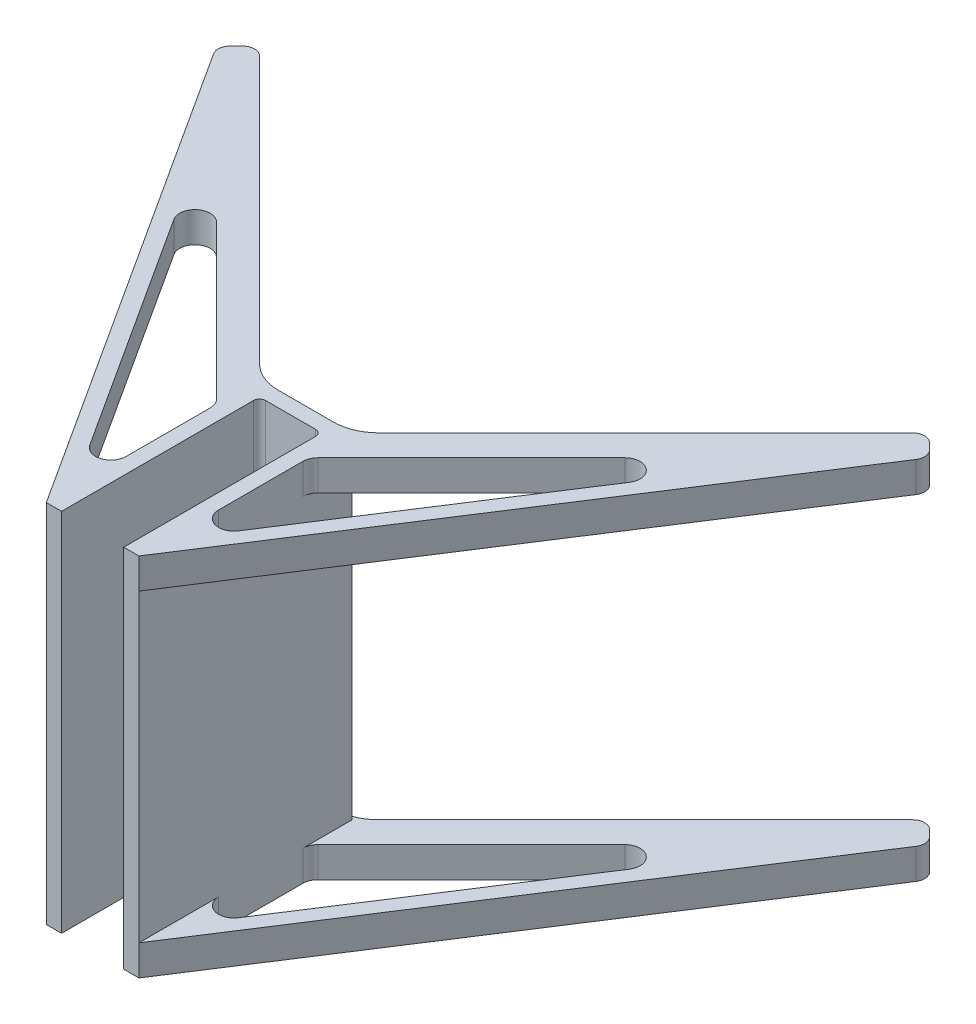
from build123d import *

# Parameters (mm, degrees)
BOSS_EXTRUDE1_DEPTH = 120
BOSS_EXTRUDE2_DEPTH = 10
BOSS_EXTRUDE3_START = 120
BOSS_EXTRUDE3_DEPTH = 10
FILLET1_R           = 5
FILLET2_R           = 15
FILLET3_R           = 2
FILLET4_R           = 4


with BuildPart() as part:
    # Sketch1 → Boss-Extrude1 (new body)
    with BuildSketch(Plane(origin=(0, 0, 0), x_dir=(1, 0, 0), z_dir=(0, 1, 0))):
        Polygon((-15.2, -55.784127273), (-15.2, -65), (-10.2, -65), (-10.2, -20.4), (-10.2, 0), (10.2, 0), (10.2, -20.4), (10.2, -65), (15.2, -65), (15.2, -55.784127273), (15.2, -9.142135624), (15.2, 5), (-15.2, 5), (-15.2, -9.142135624), align=None)
    extrude(amount=BOSS_EXTRUDE1_DEPTH)

    # Sketch1<3> → Boss-Extrude2 (add)
    with BuildSketch(Plane(origin=(0, 0, 0), x_dir=(1, 0, 0), z_dir=(0, 1, 0))):
        Polygon((-110, 99.8), (-117.071067812, 92.728932188), (-100.263572466, 75.921436842), (-15.2, -9.142135624), (-15.2, 5), align=None)
        Polygon((110, 99.8), (15.2, 5), (15.2, -9.142135624), (100.263572466, 75.921436842), (117.071067812, 92.728932188), align=None)
        Polygon((100.263572466, 75.921436842), (15.2, -55.784127273), (15.2, -65), (117.071067812, 92.728932188), align=None)
        Polygon((-100.263572466, 75.921436842), (-117.071067812, 92.728932188), (-15.2, -65), (-15.2, -55.784127273), align=None)
    extrude(amount=BOSS_EXTRUDE2_DEPTH)

    # Sketch1<4> → Boss-Extrude3 (add)
    with BuildSketch(Plane(origin=(0, 0, 0), x_dir=(1, 0, 0), z_dir=(0, 1, 0)).offset(BOSS_EXTRUDE3_START)):
        Polygon((-110, 99.8), (-117.071067812, 92.728932188), (-100.263572466, 75.921436842), (-15.2, -9.142135624), (-15.2, 5), align=None)
        Polygon((-100.263572466, 75.921436842), (-117.071067812, 92.728932188), (-15.2, -65), (-15.2, -55.784127273), align=None)
        Polygon((110, 99.8), (15.2, 5), (15.2, -9.142135624), (100.263572466, 75.921436842), (117.071067812, 92.728932188), align=None)
        Polygon((100.263572466, 75.921436842), (15.2, -55.784127273), (15.2, -65), (117.071067812, 92.728932188), align=None)
    extrude(amount=-BOSS_EXTRUDE3_DEPTH)

    # Fillet1
    fillet1_edges = [part.edges().sort_by_distance(p)[0] for p in [
        (15.2, 5, 9.142135624),
        (100.263572466, 5, -75.921436842),
        (15.2, 5, 55.784127273),
        (-15.2, 5, 55.784127273),
        (-100.263572466, 5, -75.921436842),
        (-15.2, 5, 9.142135624),
        (-100.263572466, 115, -75.921436842),
        (-15.2, 115, 55.784127273),
        (-15.2, 115, 9.142135624),
        (15.2, 115, 55.784127273),
        (100.263572466, 115, -75.921436842),
        (15.2, 115, 9.142135624),
    ]]
    fillet(fillet1_edges, radius=FILLET1_R)

    # Fillet2
    fillet2_edges = [part.edges().sort_by_distance(p)[0] for p in [
        (-15.2, 115, -5),
        (15.2, 115, -5),
        (15.2, 5, -5),
        (-15.2, 5, -5),
    ]]
    fillet(fillet2_edges, radius=FILLET2_R)

    # Fillet3
    fillet3_edges = [part.edges().sort_by_distance(p)[0] for p in [
        (10.2, 60, 0),
        (-10.2, 60, 0),
    ]]
    fillet(fillet3_edges, radius=FILLET3_R)

    # Fillet4
    fillet4_edges = [part.edges().sort_by_distance(p)[0] for p in [
        (117.071067812, 5, -92.728932188),
        (110, 5, -99.8),
        (-110, 5, -99.8),
        (-117.071067812, 5, -92.728932188),
        (-117.071067812, 115, -92.728932188),
        (-110, 115, -99.8),
        (110, 115, -99.8),
        (117.071067812, 115, -92.728932188),
    ]]
    fillet(fillet4_edges, radius=FILLET4_R)


solid = part.part
